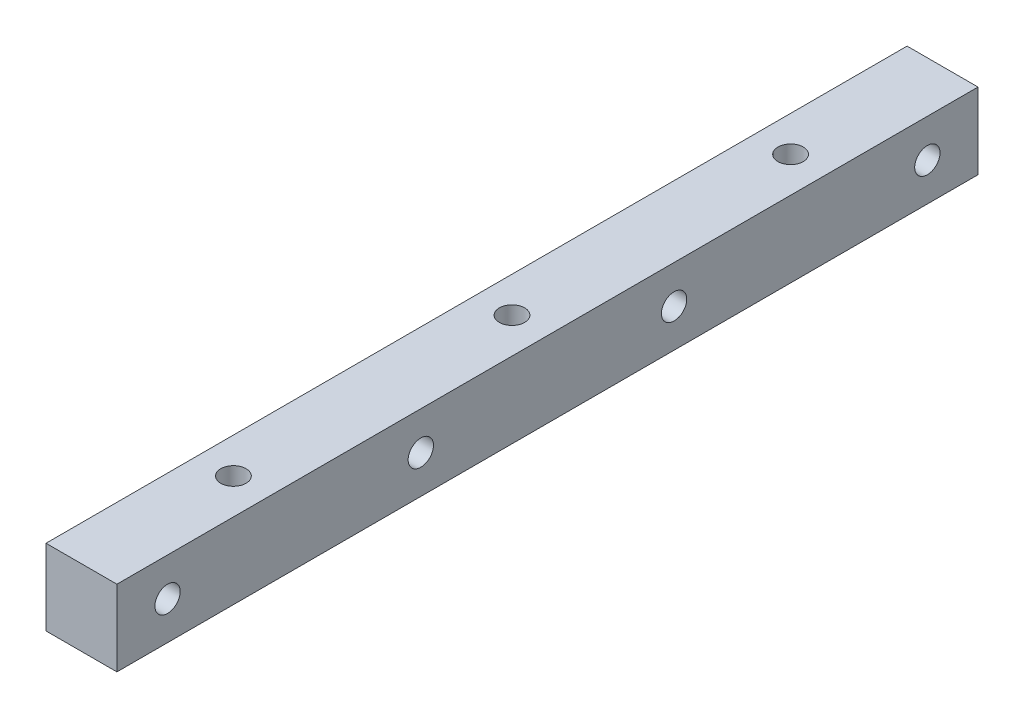
from build123d import *

# Parameters (mm, degrees)
SKETCH_1_W          = 5.6
SKETCH_1_H          = 6
EXTRUDE_1_DEPTH     = 34
CUT_EXTRUDE_3_REACH = 36.639
SKETCH_4_R          = 1
CUT_EXTRUDE_4_REACH = 36.977
SKETCH_5_R          = 1


with BuildPart() as part:
    # 草图1 → 凸台-拉伸1 (new, symmetric)
    with BuildSketch(Plane.XY):
        with Locations((0, 3)):
            Rectangle(SKETCH_1_W, SKETCH_1_H)
    extrude(amount=EXTRUDE_1_DEPTH, both=True)

    # 草图4 → 切除-拉伸3 (cut, up to next)
    with BuildSketch(Plane.XZ, mode=Mode.PRIVATE) as cut_extrude_3_sk1:
        Circle(SKETCH_4_R)
    cut_extrude_3_tool1 = extrude(cut_extrude_3_sk1.sketch, amount=-CUT_EXTRUDE_3_REACH, mode=Mode.PRIVATE) & part.part
    # 草图4 → 切除-拉伸3 (cut, up to next)
    with BuildSketch(Plane.XZ, mode=Mode.PRIVATE) as cut_extrude_3_sk2:
        with Locations((0, 22)):
            Circle(SKETCH_4_R)
    cut_extrude_3_tool2 = extrude(cut_extrude_3_sk2.sketch, amount=-CUT_EXTRUDE_3_REACH, mode=Mode.PRIVATE) & part.part
    # 草图4 → 切除-拉伸3 (cut, up to next)
    with BuildSketch(Plane.XZ, mode=Mode.PRIVATE) as cut_extrude_3_sk3:
        with Locations((0, -22)):
            Circle(SKETCH_4_R)
    cut_extrude_3_tool3 = extrude(cut_extrude_3_sk3.sketch, amount=-CUT_EXTRUDE_3_REACH, mode=Mode.PRIVATE) & part.part
    add(cut_extrude_3_tool1.solids().sort_by_distance((0, 0, 0))[0], mode=Mode.SUBTRACT)
    add(cut_extrude_3_tool2.solids().sort_by_distance((0, 0, 22))[0], mode=Mode.SUBTRACT)
    add(cut_extrude_3_tool3.solids().sort_by_distance((0, 0, -22))[0], mode=Mode.SUBTRACT)

    # 草图5 → 切除-拉伸4 (cut, up to next)
    with BuildSketch(Plane(origin=(2.8, 0, 0), x_dir=(0, 0, -1), z_dir=(1, 0, 0)), mode=Mode.PRIVATE) as cut_extrude_4_sk1:
        with Locations(Location((-30, 3, 0), (0, 0, 90))):
            Circle(SKETCH_5_R)
    cut_extrude_4_tool1 = extrude(cut_extrude_4_sk1.sketch, amount=-CUT_EXTRUDE_4_REACH, mode=Mode.PRIVATE) & part.part
    # 草图5 → 切除-拉伸4 (cut, up to next)
    with BuildSketch(Plane(origin=(2.8, 0, 0), x_dir=(0, 0, -1), z_dir=(1, 0, 0)), mode=Mode.PRIVATE) as cut_extrude_4_sk2:
        with Locations(Location((-10, 3, 0), (0, 0, 90))):
            Circle(SKETCH_5_R)
    cut_extrude_4_tool2 = extrude(cut_extrude_4_sk2.sketch, amount=-CUT_EXTRUDE_4_REACH, mode=Mode.PRIVATE) & part.part
    # 草图5 → 切除-拉伸4 (cut, up to next)
    with BuildSketch(Plane(origin=(2.8, 0, 0), x_dir=(0, 0, -1), z_dir=(1, 0, 0)), mode=Mode.PRIVATE) as cut_extrude_4_sk3:
        with Locations(Location((10, 3, 0), (0, 0, 90))):
            Circle(SKETCH_5_R)
    cut_extrude_4_tool3 = extrude(cut_extrude_4_sk3.sketch, amount=-CUT_EXTRUDE_4_REACH, mode=Mode.PRIVATE) & part.part
    # 草图5 → 切除-拉伸4 (cut, up to next)
    with BuildSketch(Plane(origin=(2.8, 0, 0), x_dir=(0, 0, -1), z_dir=(1, 0, 0)), mode=Mode.PRIVATE) as cut_extrude_4_sk4:
        with Locations(Location((30, 3, 0), (0, 0, 90))):
            Circle(SKETCH_5_R)
    cut_extrude_4_tool4 = extrude(cut_extrude_4_sk4.sketch, amount=-CUT_EXTRUDE_4_REACH, mode=Mode.PRIVATE) & part.part
    add(cut_extrude_4_tool1.solids().sort_by_distance((2.8, 3, 30))[0], mode=Mode.SUBTRACT)
    add(cut_extrude_4_tool2.solids().sort_by_distance((2.8, 3, 10))[0], mode=Mode.SUBTRACT)
    add(cut_extrude_4_tool3.solids().sort_by_distance((2.8, 3, -10))[0], mode=Mode.SUBTRACT)
    add(cut_extrude_4_tool4.solids().sort_by_distance((2.8, 3, -30))[0], mode=Mode.SUBTRACT)


solid = part.part
